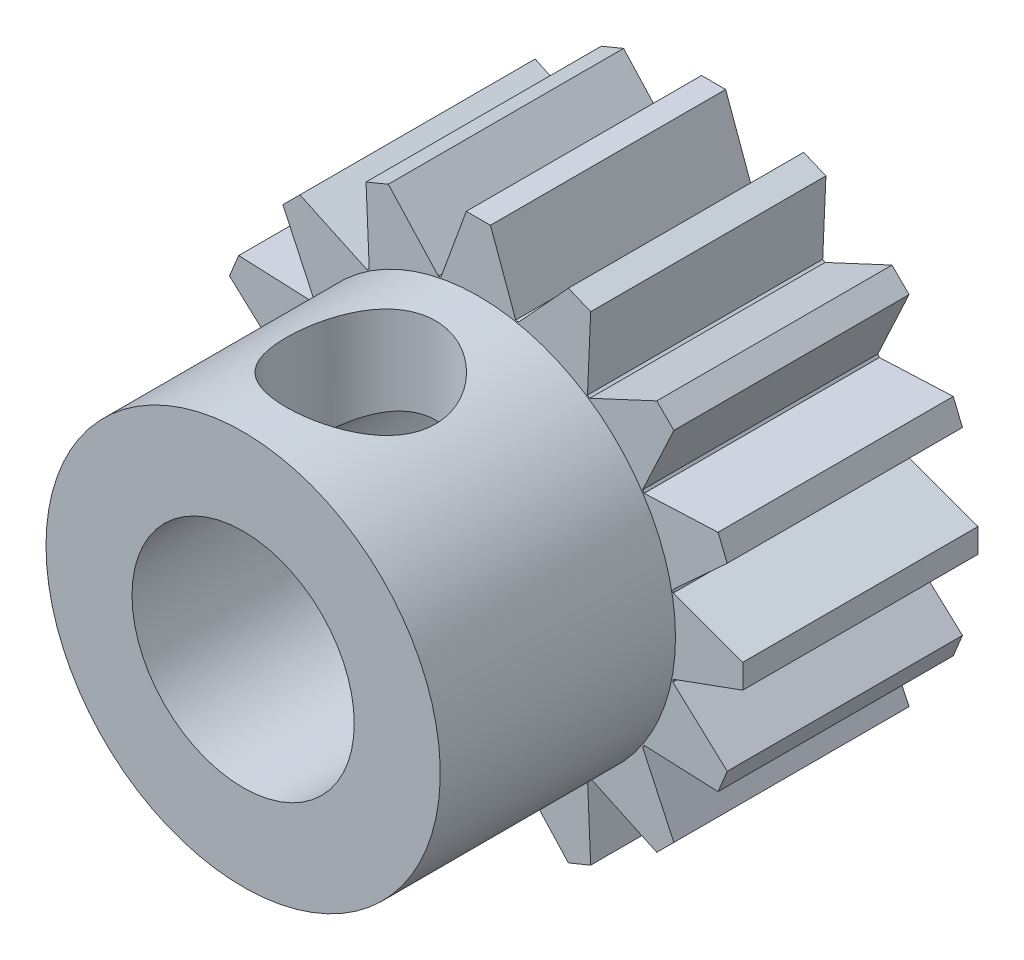
from build123d import *

# Parameters (mm, degrees)
BOSS_EXTRUDE1_DEPTH              = 6.35
SKETCH2_W                        = 5.3213
SKETCH2_H                        = 6.35
F_12_CLEARANCE_HOLE1_D           = 6
F_21_0_159_DIAMETER_HOLE1_REACH  = 19.23
F_21_0_159_DIAMETER_HOLE1_BORE_R = 2.0193


with BuildPart() as part:
    # Sketch1 → Boss-Extrude1 (new body)
    with BuildSketch(Plane.XY.offset(3.175)):
        with BuildLine():
            Line((2.945181061, 4.475719374), (3.032230323, 6.469475256))
            Line((3.032230323, 6.469475256), (2.430499075, 6.7187205))
            Line((2.430499075, 6.7187205), (1.082253901, 5.247369083))
            ThreePointArc((1.082253901, 5.247369083), (1.045257317, 5.254863741), (1.008208849, 5.262097559))
            Line((1.008208849, 5.262097559), (0.325654523, 7.137400133))
            Line((0.325654523, 7.137400133), (-0.325654702, 7.137400133))
            Line((-0.325654702, 7.137400133), (-1.008209026, 5.262097541))
            ThreePointArc((-1.008209026, 5.262097541), (-1.045257435, 5.254863734), (-1.082253959, 5.247369087))
            Line((-1.082253959, 5.247369087), (-2.43049913, 6.718720502))
            Line((-2.43049913, 6.718720502), (-3.03223038, 6.469475257))
            Line((-3.03223038, 6.469475257), (-2.945181121, 4.475719388))
            ThreePointArc((-2.945181121, 4.475719388), (-2.976641184, 4.454858374), (-3.007953492, 4.433776229))
            Line((-3.007953492, 4.433776229), (-4.816631407, 5.277176573))
            Line((-4.816631407, 5.277176573), (-5.277176625, 4.816631474))
            Line((-5.277176625, 4.816631474), (-4.433776215, 3.007953457))
            ThreePointArc((-4.433776215, 3.007953457), (-4.454858319, 2.976641205), (-4.475719295, 2.945181199))
            Line((-4.475719295, 2.945181199), (-6.469475174, 3.032230463))
            Line((-6.469475174, 3.032230463), (-6.718720419, 2.430499213))
            Line((-6.718720419, 2.430499213), (-5.247368979, 1.082254018))
            ThreePointArc((-5.247368979, 1.082254018), (-5.254863646, 1.045257392), (-5.26209747, 1.008208882))
            Line((-5.26209747, 1.008208882), (-7.137400023, 0.325654551))
            Line((-7.137400023, 0.325654551), (-7.137400023, -0.325654674))
            Line((-7.137400023, -0.325654674), (-5.262097383, -1.008209015))
            ThreePointArc((-5.262097383, -1.008209015), (-5.254863591, -1.045257342), (-5.24736896, -1.082253784))
            Line((-5.24736896, -1.082253784), (-6.71872042, -2.430498991))
            Line((-6.71872042, -2.430498991), (-6.469475175, -3.032230242))
            Line((-6.469475175, -3.032230242), (-4.475719227, -2.945180979))
            ThreePointArc((-4.475719227, -2.945180979), (-4.454858236, -2.976641007), (-4.433776114, -3.007953281))
            Line((-4.433776114, -3.007953281), (-5.277176492, -4.816631269))
            Line((-5.277176492, -4.816631269), (-4.816631393, -5.277176487))
            Line((-4.816631393, -5.277176487), (-3.007953296, -4.433776039))
            ThreePointArc((-3.007953296, -4.433776039), (-2.976641082, -4.454858118), (-2.945181114, -4.475719068))
            Line((-2.945181114, -4.475719068), (-3.03223038, -6.469475037))
            Line((-3.03223038, -6.469475037), (-2.43049913, -6.718720282))
            Line((-2.43049913, -6.718720282), (-1.082253881, -5.24736878))
            ThreePointArc((-1.082253881, -5.24736878), (-1.045257351, -5.254863427), (-1.008208937, -5.262097234))
            Line((-1.008208937, -5.262097234), (-0.325654579, -7.137399864))
            Line((-0.325654579, -7.137399864), (0.325654646, -7.137399864))
            Line((0.325654646, -7.137399864), (1.008209007, -5.262097205))
            ThreePointArc((1.008209007, -5.262097205), (1.045257357, -5.25486341), (1.082253822, -5.247368775))
            Line((1.082253822, -5.247368775), (2.430499075, -6.718720281))
            Line((2.430499075, -6.718720281), (3.032230325, -6.469475036))
            Line((3.032230325, -6.469475036), (2.945181058, -4.475719052))
            ThreePointArc((2.945181058, -4.475719052), (2.976641071, -4.454858071), (3.00795333, -4.433775961))
            Line((3.00795333, -4.433775961), (4.816631352, -5.277176352))
            Line((4.816631352, -5.277176352), (5.27717657, -4.816631253))
            Line((5.27717657, -4.816631253), (4.433776119, -3.007953154))
            ThreePointArc((4.433776119, -3.007953154), (4.454858198, -2.976640942), (4.475719148, -2.945180976))
            Line((4.475719148, -2.945180976), (6.469475118, -3.032230242))
            Line((6.469475118, -3.032230242), (6.718720363, -2.430498991))
            Line((6.718720363, -2.430498991), (5.247368883, -1.082253764))
            ThreePointArc((5.247368883, -1.082253764), (5.254863535, -1.045257218), (5.262097345, -1.008208788))
            Line((5.262097345, -1.008208788), (7.137399945, -0.32565444))
            Line((7.137399945, -0.32565444), (7.137399945, 0.325654785))
            Line((7.137399945, 0.325654785), (5.262097343, 1.008209124))
            ThreePointArc((5.262097343, 1.008209124), (5.254863542, 1.045257505), (5.247368901, 1.082254002))
            Line((5.247368901, 1.082254002), (6.718720362, 2.430499213))
            Line((6.718720362, 2.430499213), (6.469475118, 3.032230461))
            Line((6.469475118, 3.032230461), (4.475719213, 2.9451812))
            ThreePointArc((4.475719213, 2.9451812), (4.45485821, 2.976641248), (4.433776076, 3.007953541))
            Line((4.433776076, 3.007953541), (5.277176433, 4.81663149))
            Line((5.277176433, 4.81663149), (4.816631336, 5.277176706))
            Line((4.816631336, 5.277176706), (3.007953315, 4.433776294))
            ThreePointArc((3.007953315, 4.433776294), (2.976641065, 4.454858399), (2.945181061, 4.475719374))
        make_face()
    extrude(amount=-BOSS_EXTRUDE1_DEPTH)

    # Sketch2 → Revolve1 (revolve)
    with BuildSketch(Plane.XZ, mode=Mode.PRIVATE) as revolve1_sk:
        with Locations((2.66065, 6.35)):
            Rectangle(SKETCH2_W, SKETCH2_H)
    revolve(revolve1_sk.sketch.rotate(Axis((0, 0, 9.525), (0, 0, -1)), 180), axis=Axis((0, 0, 9.525), (0, 0, -1)))

    # #12 Clearance Hole1 (through all)
    with Locations(Plane.XY.offset(9.525)):
        with Locations((0, 0)):
            Hole(F_12_CLEARANCE_HOLE1_D / 2)

    # #21 (0.159) Diameter Hole1 bore (on position points) → #21 (0.159) Diameter Hole1 (cut, up to next)
    with BuildSketch(Plane(origin=(0, 5.3213, 6.35), x_dir=(1, 0, 0), z_dir=(0, 1, 0)), mode=Mode.PRIVATE) as f_21_0_159_diameter_hole1_sk1:
        Circle(F_21_0_159_DIAMETER_HOLE1_BORE_R)
    f_21_0_159_diameter_hole1_tool1 = extrude(f_21_0_159_diameter_hole1_sk1.sketch, amount=-F_21_0_159_DIAMETER_HOLE1_REACH, mode=Mode.PRIVATE) & part.part
    add(f_21_0_159_diameter_hole1_tool1.solids().sort_by_distance((0, 5.3213, 6.35))[0], mode=Mode.SUBTRACT)


solid = part.part
